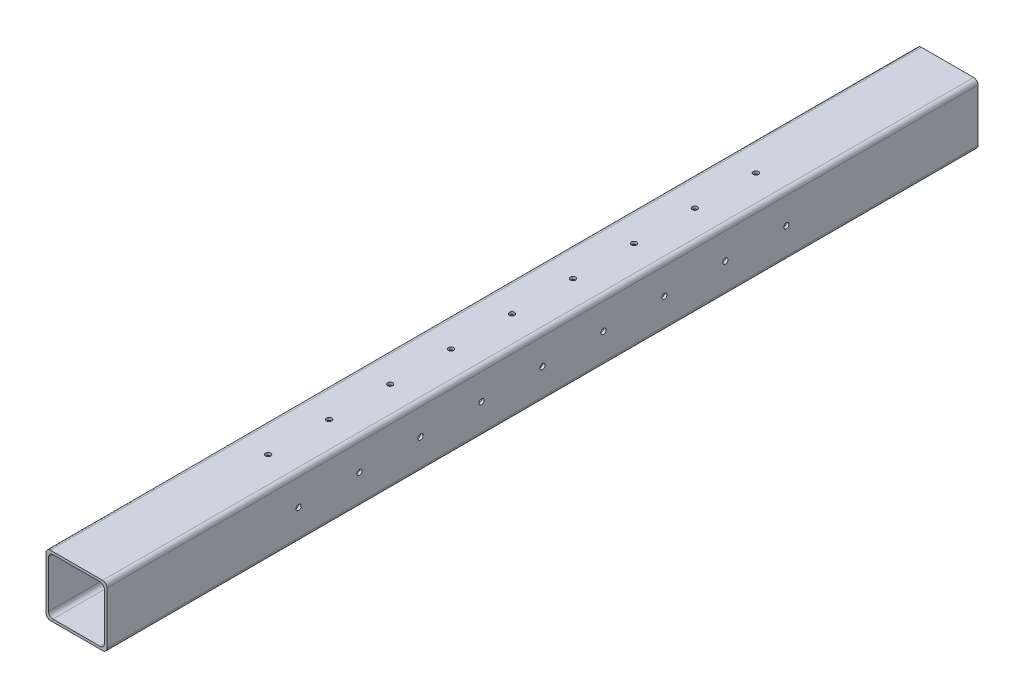
from build123d import *

# Parameters (mm, degrees)
SKETCH1_W           = 70
SKETCH1_H           = 70
SKETCH1_W_2         = 64
SKETCH1_H_2         = 64
BOSS_EXTRUDE1_DEPTH = 1000
FILLET1_R           = 5
SKETCH5_R           = 3
CUT_EXTRUDE3_DEPTH  = 70
LPATTERN1_COUNT     = 5
LPATTERN1_PITCH     = 70
LPATTERN1_COL_COUNT = 5
LPATTERN1_COL_PITCH = 70
SKETCH6_R           = 3
CUT_EXTRUDE4_DEPTH  = 70
LPATTERN2_COUNT     = 5
LPATTERN2_PITCH     = 70
LPATTERN2_COL_COUNT = 5
LPATTERN2_COL_PITCH = 70


with BuildPart() as part:
    # Sketch1 → Boss-Extrude1 (new body)
    with BuildSketch(Plane.XY):
        with Locations((35, 35)):
            Rectangle(SKETCH1_W, SKETCH1_H)
        with Locations((35, 35)):
            Rectangle(SKETCH1_W_2, SKETCH1_H_2, mode=Mode.SUBTRACT)
    extrude(amount=BOSS_EXTRUDE1_DEPTH)

    # Fillet1
    fillet1_edges = [part.edges().sort_by_distance(p)[0] for p in [
        (3, 67, 500),
        (3, 3, 500),
        (67, 3, 500),
        (67, 67, 500),
        (0, 70, 500),
        (70, 70, 500),
        (70, 0, 500),
        (0, 0, 500),
    ]]
    fillet(fillet1_edges, radius=FILLET1_R)

    # Sketch5 → Cut-Extrude3 (cut)
    with BuildSketch(Plane(origin=(0, 70, 0), x_dir=(1, 0, 0), z_dir=(0, 1, 0))):
        with Locations(Location((35, -500, 0), (0, 0, 270))):
            Circle(SKETCH5_R)
    cut_extrude3 = extrude(amount=-CUT_EXTRUDE3_DEPTH, mode=Mode.SUBTRACT)

    # LPattern1: Cut-Extrude3 ×5
    with Locations(*[(0, 0, i * LPATTERN1_PITCH) for i in range(1, LPATTERN1_COUNT)]):
        add(cut_extrude3, mode=Mode.SUBTRACT)

    # LPattern1 col: Cut-Extrude3 ×5
    with Locations(*[(0, 0, -i * LPATTERN1_COL_PITCH) for i in range(1, LPATTERN1_COL_COUNT)]):
        add(cut_extrude3, mode=Mode.SUBTRACT)

    # Sketch6 → Cut-Extrude4 (cut)
    with BuildSketch(Plane.ZY):
        with Locations(Location((500, 35, 0), (0, 0, 270))):
            Circle(SKETCH6_R)
    cut_extrude4 = extrude(amount=-CUT_EXTRUDE4_DEPTH, mode=Mode.SUBTRACT)

    # LPattern2: Cut-Extrude4 ×5
    with Locations(*[(0, 0, -i * LPATTERN2_PITCH) for i in range(1, LPATTERN2_COUNT)]):
        add(cut_extrude4, mode=Mode.SUBTRACT)

    # LPattern2 col: Cut-Extrude4 ×5
    with Locations(*[(0, 0, i * LPATTERN2_COL_PITCH) for i in range(1, LPATTERN2_COL_COUNT)]):
        add(cut_extrude4, mode=Mode.SUBTRACT)


solid = part.part
